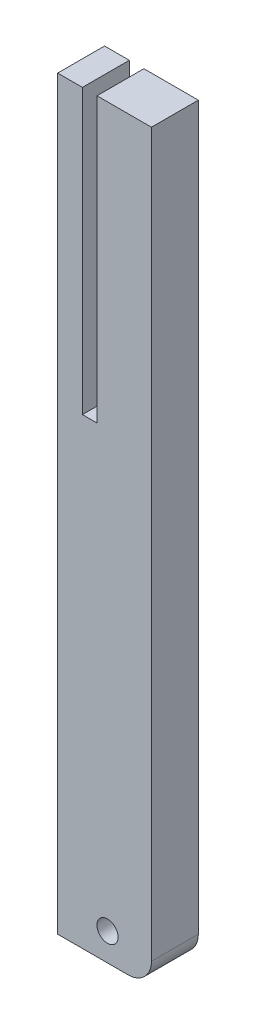
from build123d import *

# Parameters (mm, degrees)
SKETCH1_W           = 10.16
SKETCH1_H           = 80.800676527
BOSS_EXTRUDE1_DEPTH = 5.08
FILLET1_R           = 2.54
SKETCH2_R           = 1.143
SKETCH2_W           = 1.579389271
SKETCH2_H           = 30.704752465
CUT_EXTRUDE1_DEPTH  = 5.08


with BuildPart() as part:
    # Sketch1 → Boss-Extrude1 (new body)
    with BuildSketch(Plane.XY):
        with Locations((-3.236775432, 33.601000469)):
            Rectangle(SKETCH1_W, SKETCH1_H)
    extrude(amount=BOSS_EXTRUDE1_DEPTH)

    # Fillet1
    fillet1_edges = [part.edges().sort_by_distance(p)[0] for p in [
        (1.843224568, -6.799337795, 2.54),
    ]]
    fillet(fillet1_edges, radius=FILLET1_R)

    # Sketch2 → Cut-Extrude1 (cut)
    with BuildSketch(Plane.XY.offset(5.08)):
        with Locations((-2.915125323, -3.81)):
            Circle(SKETCH2_R)
        with Locations((-4.845930623, 58.6489625)):
            Rectangle(SKETCH2_W, SKETCH2_H)
    extrude(amount=-CUT_EXTRUDE1_DEPTH, mode=Mode.SUBTRACT)


solid = part.part
